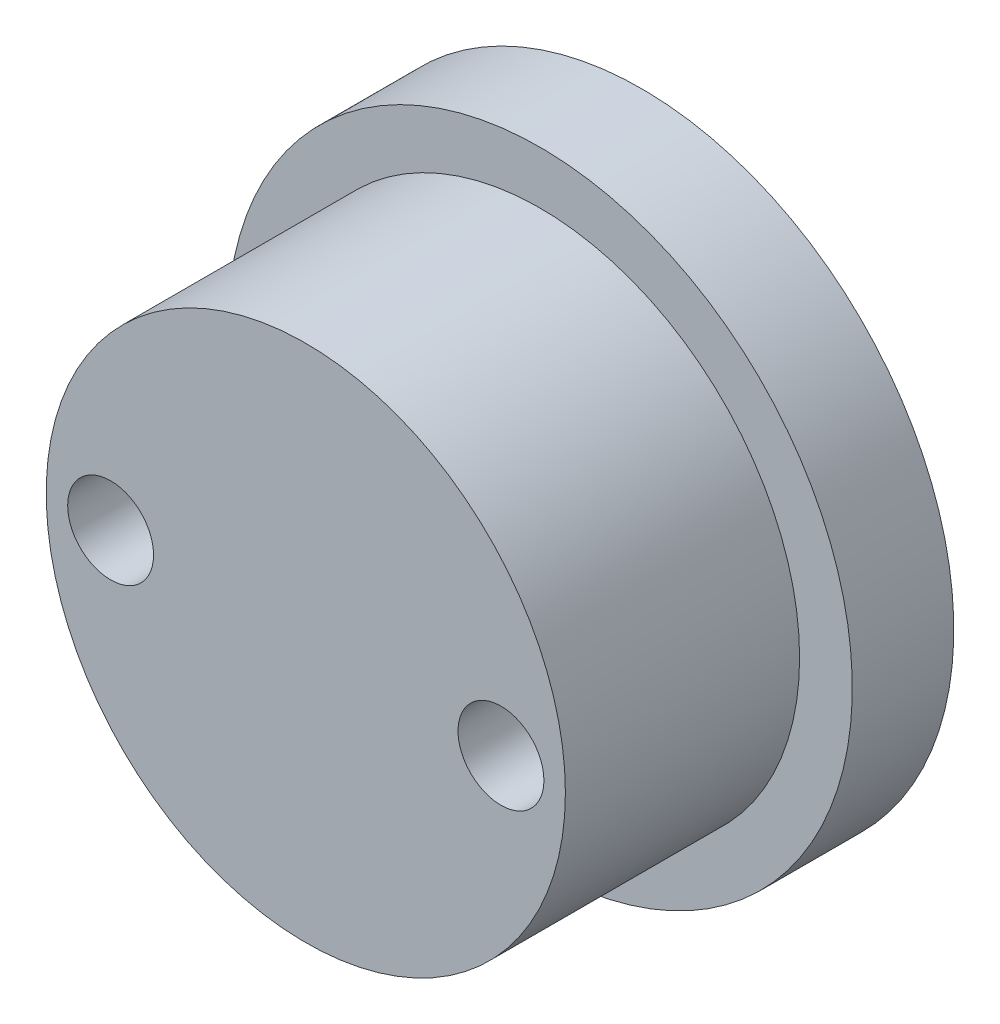
from build123d import *

# Parameters (mm, degrees)
SKETCH_1_R          = 12
EXTRUDE_1_DEPTH     = 12.9
CUT_EXTRUDE_START   = -9
SKETCH_2_R          = 12
SKETCH_2_R_2        = 9.975
CUT_EXTRUDE_1_DEPTH = 9
SKETCH_3_R          = 1.65
CUT_EXTRUDE_2_DEPTH = 12.9


with BuildPart() as part:
    # ｽｹｯﾁ1 → ﾎﾞｽ - 押し出し1 (new body)
    with BuildSketch(Plane.XY):
        with Locations(Location((0, 0, 0), (0, 0, 180))):
            Circle(SKETCH_1_R)
    extrude(amount=EXTRUDE_1_DEPTH)

    # ｽｹｯﾁ2 → ｶｯﾄ - 押し出し1 (cut)
    with BuildSketch(Plane.XY.offset(12.9).offset(CUT_EXTRUDE_START)):
        with Locations(Location((0, 0, 0), (0, 0, 180))):
            Circle(SKETCH_2_R)
        Circle(SKETCH_2_R_2, mode=Mode.SUBTRACT)
    extrude(amount=CUT_EXTRUDE_1_DEPTH, mode=Mode.SUBTRACT)

    # ｽｹｯﾁ3 → ｶｯﾄ - 押し出し2 (cut)
    with BuildSketch(Plane(origin=(0, 0, 0), x_dir=(-1, 0, 0), z_dir=(0, 0, -1))):
        with Locations((7.5, 0)):
            Circle(SKETCH_3_R)
        with Locations(Location((-7.5, 0, 0), (0, 0, 180))):
            Circle(SKETCH_3_R)
    extrude(amount=-CUT_EXTRUDE_2_DEPTH, mode=Mode.SUBTRACT)


solid = part.part
